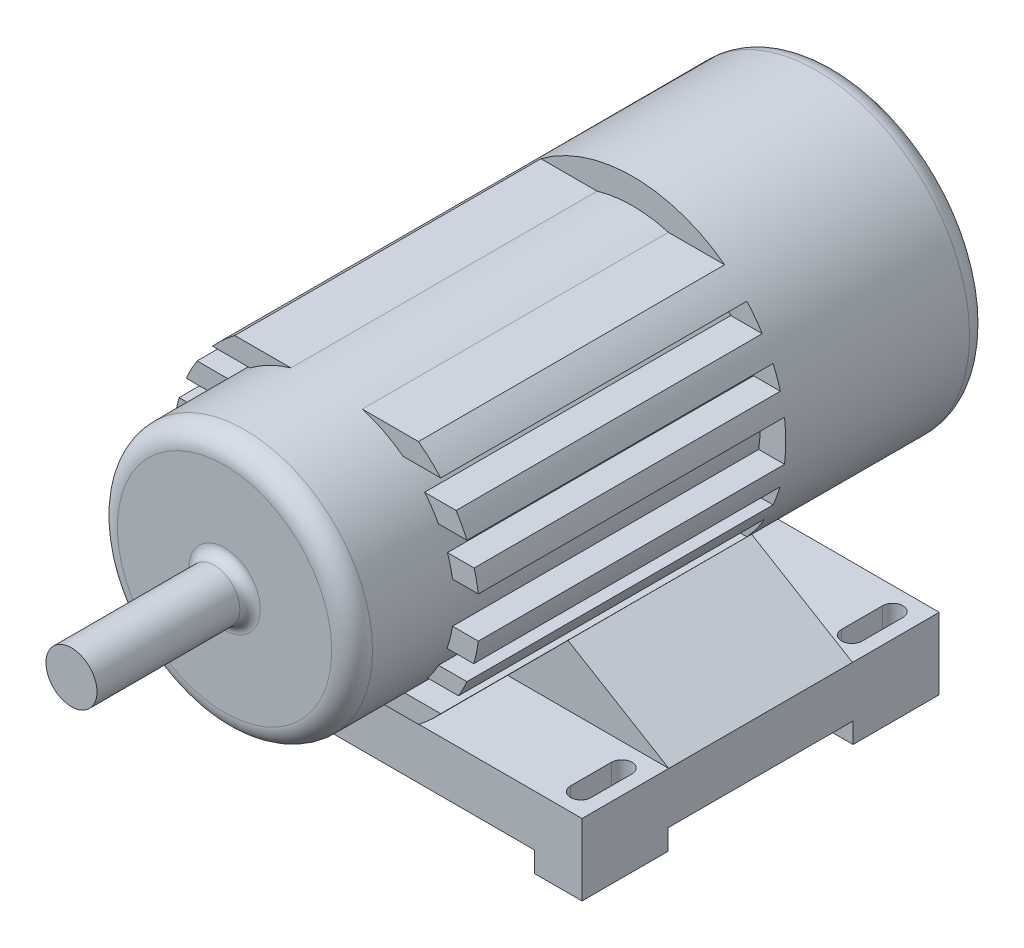
from build123d import *
from build123d.topology import SkipClean

# Parameters (mm, degrees)
SKETCH1_R            = 150
BOSS_EXTRUDE1_DEPTH  = 200
BOSS_EXTRUDE11_DEPTH = 300
BOSS_EXTRUDE14_START = -300
SKETCH12_R           = 125
BOSS_EXTRUDE14_DEPTH = 400
SKETCH13_W           = 46.677917496
SKETCH13_H           = 84.453402707
SKETCH13_H_2         = 84.453402706
SKETCH13_W_2         = 50
BOSS_EXTRUDE15_DEPTH = 50
SKETCH13_3_W         = 46.677917496
SKETCH13_3_H         = 84.453402706
SKETCH13_3_H_2       = 84.453402707
SKETCH13_3_W_2       = 50
BOSS_EXTRUDE16_DEPTH = 20
BOSS_EXTRUDE17_DEPTH = 90
SKETCH16_R           = 25
BOSS_EXTRUDE18_DEPTH = 150
FILLET2_R            = 10
FILLET3_R            = 20


with BuildPart() as part:
    # Sketch1 → Boss-Extrude1 (new body)
    with BuildSketch(Plane.XY):
        Circle(SKETCH1_R)
    extrude(amount=BOSS_EXTRUDE1_DEPTH)

    # Sketch7 → Boss-Extrude11 (add)
    with SkipClean():  # the faces are left unmerged after this step: merging them gives an invalid solid
        with BuildSketch(Plane.XY.offset(200)):
            with BuildLine():
                Line((-90, 120), (90, 120))
                ThreePointArc((90, 120), (101.396020382, 110.538893837), (111.803398875, 100))
                Line((111.803398875, 100), (-111.803398875, 100))
                ThreePointArc((-111.803398875, 100), (-101.396020382, 110.538893837), (-90, 120))
            make_face()
            with BuildLine():
                Line((-126.885775404, 80), (126.885775404, 80))
                ThreePointArc((126.885775404, 80), (132.559251115, 70.200035213), (137.477270849, 60))
                Line((137.477270849, 60), (-137.477270849, 60))
                ThreePointArc((-137.477270849, 60), (-132.559251115, 70.200035213), (-126.885775404, 80))
            make_face()
            with BuildLine():
                Line((144.16342013, -41.435592144), (-144.16342013, -41.435592144))
                ThreePointArc((-144.16342013, -41.435592144), (-146.803816882, -30.799989431), (-148.660687473, -20))
                Line((-148.660687473, -20), (148.660687473, -20))
                ThreePointArc((148.660687473, -20), (146.803816882, -30.799989431), (144.16342013, -41.435592144))
            make_face()
            with BuildLine():
                Line((111.803398875, -100), (-111.803398875, -100))
                ThreePointArc((-111.803398875, -100), (-101.396020382, -110.538893837), (-90, -120))
                Line((-90, -120), (90, -120))
                ThreePointArc((90, -120), (101.396020382, -110.538893837), (111.803398875, -100))
            make_face()
            with BuildLine():
                Line((144.568322948, 40), (-144.568322948, 40))
                ThreePointArc((-144.568322948, 40), (-146.955139883, 30.069700063), (-148.660687473, 20))
                Line((-148.660687473, 20), (148.660687473, 20))
                ThreePointArc((148.660687473, 20), (146.955139883, 30.069700063), (144.568322948, 40))
            make_face()
            with BuildLine():
                Line((137.477270849, -60), (-137.477270849, -60))
                ThreePointArc((-137.477270849, -60), (-133.599215205, -68.20007109), (-129.232599216, -76.150740639))
                Line((-129.232599216, -76.150740639), (129.232599216, -76.150740639))
                ThreePointArc((129.232599216, -76.150740639), (133.599215205, -68.20007109), (137.477270849, -60))
            make_face()
        extrude(amount=BOSS_EXTRUDE11_DEPTH)



with BuildPart() as body_2:
    # Sketch12 → Boss-Extrude14 (new body)
    with BuildSketch(Plane.XY.offset(500).offset(BOSS_EXTRUDE14_START)):
        Circle(SKETCH12_R)
    extrude(amount=BOSS_EXTRUDE14_DEPTH)


with BuildPart() as body_3:
    # Sketch13 → Boss-Extrude15 (new body)
    # profile 1 of 5: a face of its own
    with BuildSketch(Plane(origin=(0, -220, 0), x_dir=(-1, 0, 0), z_dir=(0, -1, 0))):
        Polygon((150, -99.735715433), (-153.322082504, -99.735715433), (-153.322082504, -184.18911814), (-200, -184.18911814), (-200, -365.282312727), (-153.322082504, -365.282312727), (-153.322082504, -449.735715433), (150, -449.735715433), (150, -365.282312727), (200, -365.282312727), (200, -184.18911814), (150, -184.18911814), align=None)
    # profile 2 of 5: a face of its own
    with BuildSketch(Plane(origin=(0, -220, 0), x_dir=(-1, 0, 0), z_dir=(0, -1, 0))):
        with Locations((-176.661041252, -141.962416787)):
            Rectangle(SKETCH13_W, SKETCH13_H)
        with BuildLine():
            ThreePointArc((-186.661041252, -121.962416787), (-176.661041252, -111.962416787), (-166.661041252, -121.962416787))
            Line((-166.661041252, -121.962416787), (-166.661041252, -161.962416787))
            ThreePointArc((-166.661041252, -161.962416787), (-176.661041252, -171.962416787), (-186.661041252, -161.962416787))
            Line((-186.661041252, -161.962416787), (-186.661041252, -121.962416787))
        make_face(mode=Mode.SUBTRACT)
    # profile 3 of 5: a face of its own
    with BuildSketch(Plane(origin=(0, -220, 0), x_dir=(-1, 0, 0), z_dir=(0, -1, 0))):
        with Locations((-176.661041252, -407.50901408)):
            Rectangle(SKETCH13_W, SKETCH13_H_2)
        with BuildLine():
            Line((-166.661041252, -387.50901408), (-166.661041252, -427.50901408))
            ThreePointArc((-166.661041252, -427.50901408), (-176.661041252, -437.50901408), (-186.661041252, -427.50901408))
            Line((-186.661041252, -427.50901408), (-186.661041252, -387.50901408))
            ThreePointArc((-186.661041252, -387.50901408), (-176.661041252, -377.50901408), (-166.661041252, -387.50901408))
        make_face(mode=Mode.SUBTRACT)
    # profile 4 of 5: a face of its own
    with BuildSketch(Plane(origin=(0, -220, 0), x_dir=(-1, 0, 0), z_dir=(0, -1, 0))):
        with Locations((175, -407.50901408)):
            Rectangle(SKETCH13_W_2, SKETCH13_H_2)
        with BuildLine():
            Line((185, -387.50901408), (185, -427.50901408))
            ThreePointArc((185, -427.50901408), (175, -437.50901408), (165, -427.50901408))
            Line((165, -427.50901408), (165, -387.50901408))
            ThreePointArc((165, -387.50901408), (175, -377.50901408), (185, -387.50901408))
        make_face(mode=Mode.SUBTRACT)
    # profile 5 of 5: a face of its own
    with BuildSketch(Plane(origin=(0, -220, 0), x_dir=(-1, 0, 0), z_dir=(0, -1, 0))):
        with Locations((175, -141.962416787)):
            Rectangle(SKETCH13_W_2, SKETCH13_H)
        with BuildLine():
            ThreePointArc((165, -121.962416787), (175, -111.962416787), (185, -121.962416787))
            Line((185, -121.962416787), (185, -161.962416787))
            ThreePointArc((185, -161.962416787), (175, -171.962416787), (165, -161.962416787))
            Line((165, -161.962416787), (165, -121.962416787))
        make_face(mode=Mode.SUBTRACT)
    extrude(amount=-BOSS_EXTRUDE15_DEPTH)

    # Sketch13<3> → Boss-Extrude16 (add)
    # profile 1 of 4: a face of its own
    with BuildSketch(Plane(origin=(0, -220, 0), x_dir=(-1, 0, 0), z_dir=(0, -1, 0))):
        with Locations((-176.661041252, -407.50901408)):
            Rectangle(SKETCH13_3_W, SKETCH13_3_H)
        with BuildLine():
            Line((-166.661041252, -387.50901408), (-166.661041252, -427.50901408))
            ThreePointArc((-166.661041252, -427.50901408), (-176.661041252, -437.50901408), (-186.661041252, -427.50901408))
            Line((-186.661041252, -427.50901408), (-186.661041252, -387.50901408))
            ThreePointArc((-186.661041252, -387.50901408), (-176.661041252, -377.50901408), (-166.661041252, -387.50901408))
        make_face(mode=Mode.SUBTRACT)
    # profile 2 of 4: a face of its own
    with BuildSketch(Plane(origin=(0, -220, 0), x_dir=(-1, 0, 0), z_dir=(0, -1, 0))):
        with Locations((-176.661041252, -141.962416787)):
            Rectangle(SKETCH13_3_W, SKETCH13_3_H_2)
        with BuildLine():
            ThreePointArc((-186.661041252, -121.962416787), (-176.661041252, -111.962416787), (-166.661041252, -121.962416787))
            Line((-166.661041252, -121.962416787), (-166.661041252, -161.962416787))
            ThreePointArc((-166.661041252, -161.962416787), (-176.661041252, -171.962416787), (-186.661041252, -161.962416787))
            Line((-186.661041252, -161.962416787), (-186.661041252, -121.962416787))
        make_face(mode=Mode.SUBTRACT)
    # profile 3 of 4: a face of its own
    with BuildSketch(Plane(origin=(0, -220, 0), x_dir=(-1, 0, 0), z_dir=(0, -1, 0))):
        with Locations((175, -407.50901408)):
            Rectangle(SKETCH13_3_W_2, SKETCH13_3_H)
        with BuildLine():
            Line((185, -387.50901408), (185, -427.50901408))
            ThreePointArc((185, -427.50901408), (175, -437.50901408), (165, -427.50901408))
            Line((165, -427.50901408), (165, -387.50901408))
            ThreePointArc((165, -387.50901408), (175, -377.50901408), (185, -387.50901408))
        make_face(mode=Mode.SUBTRACT)
    # profile 4 of 4: a face of its own
    with BuildSketch(Plane(origin=(0, -220, 0), x_dir=(-1, 0, 0), z_dir=(0, -1, 0))):
        with Locations((175, -141.962416787)):
            Rectangle(SKETCH13_3_W_2, SKETCH13_3_H_2)
        with BuildLine():
            ThreePointArc((165, -121.962416787), (175, -111.962416787), (185, -121.962416787))
            Line((185, -121.962416787), (185, -161.962416787))
            ThreePointArc((185, -161.962416787), (175, -171.962416787), (165, -161.962416787))
            Line((165, -161.962416787), (165, -121.962416787))
        make_face(mode=Mode.SUBTRACT)
    extrude(amount=BOSS_EXTRUDE16_DEPTH)


with BuildPart() as part_1:
    with SkipClean():  # the faces are left unmerged after this step: merging them gives an invalid solid
        add(part.part)

        add(body_2.part)  # Boss-Extrude17 merges body 2

        add(body_3.part)  # Boss-Extrude17 merges body 3
        # Sketch14 → Boss-Extrude17 (add, symmetric)
        with BuildSketch(Plane.XY.offset(274.735715433)):
            Polygon((-200, -170), (200, -170), (100, -110), (-100, -110), align=None)
        extrude(amount=BOSS_EXTRUDE17_DEPTH, both=True)

    # Sketch16 → Boss-Extrude18 (add)
    with BuildSketch(Plane.XY.offset(600)):
        Circle(SKETCH16_R)
    extrude(amount=BOSS_EXTRUDE18_DEPTH)

    # Fillet2
    fillet2_edges = [part_1.edges().sort_by_distance(p)[0] for p in [
        (-25, 0, 600),
    ]]
    fillet(fillet2_edges, radius=FILLET2_R)

    # Fillet3
    fillet3_edges = [part_1.edges().sort_by_distance(p)[0] for p in [
        (-125, 0, 600),
        (-150, 0, 0),
    ]]
    fillet(fillet3_edges, radius=FILLET3_R)


solid = part_1.part
